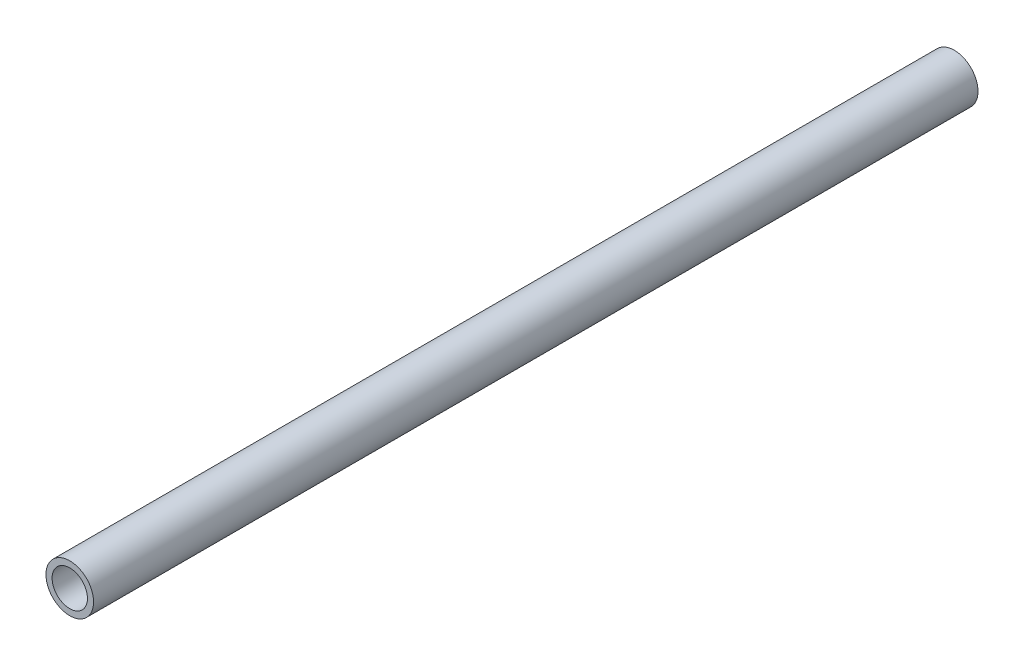
from build123d import *

# Parameters (mm, degrees)
CROQUIS1_R              = 3.5
CROQUIS1_R_2            = 2.6
SALIENTE_EXTRUIR1_DEPTH = 130


with BuildPart() as part:
    # Croquis1 → Saliente-Extruir1 (new body)
    with BuildSketch(Plane.XY):
        Circle(CROQUIS1_R)
        Circle(CROQUIS1_R_2, mode=Mode.SUBTRACT)
    extrude(amount=SALIENTE_EXTRUIR1_DEPTH)


solid = part.part
